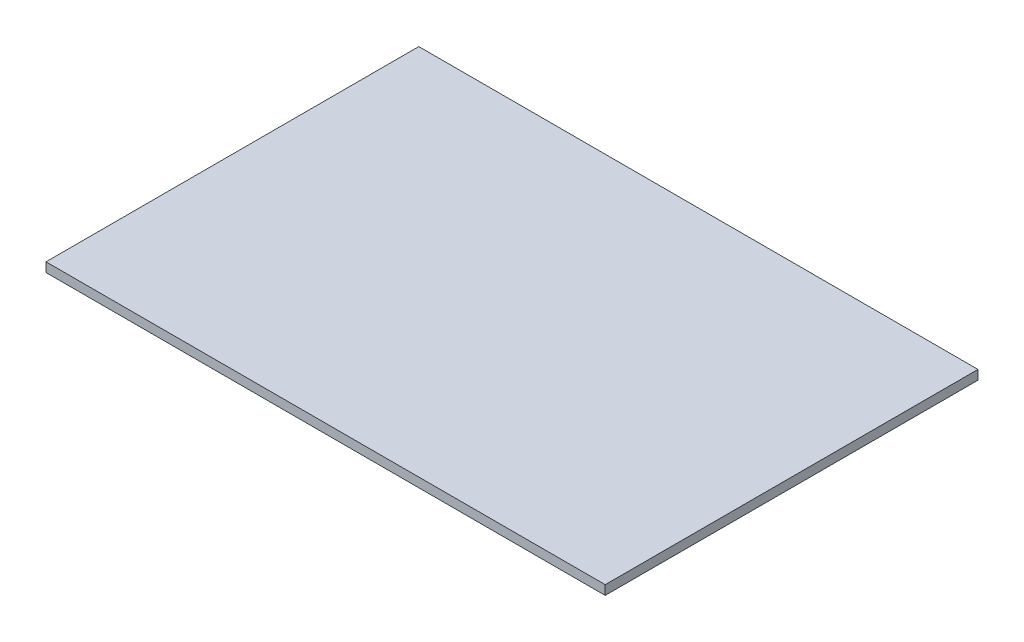
from build123d import *

# Parameters (mm, degrees)
SKETCH1_W           = 381
SKETCH1_H           = 254
BOSS_EXTRUDE1_DEPTH = 6.35


with BuildPart() as part:
    # Sketch1 → Boss-Extrude1 (new body)
    with BuildSketch(Plane(origin=(0, 0, 0), x_dir=(1, 0, 0), z_dir=(0, 1, 0))):
        Rectangle(SKETCH1_W, SKETCH1_H)
    extrude(amount=BOSS_EXTRUDE1_DEPTH)


solid = part.part
